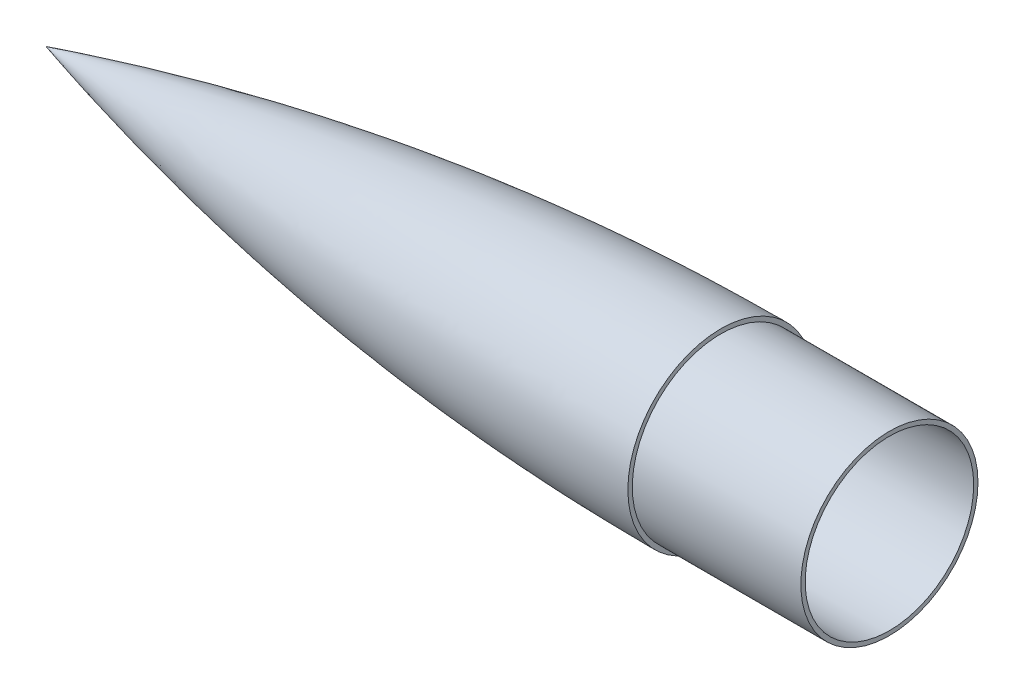
from build123d import *

# Parameters (mm, degrees)
BOSS_EXTRUDE2_DEPTH      = 71.4
BOSS_EXTRUDE2_DEPTH_BACK = 10
SKETCH7_R                = 37.5
SKETCH7_R_2              = 35.68


with BuildPart() as part:
    # Sketch6 → Revolve1 (revolve)
    with BuildSketch(Plane.XY):
        with BuildLine():
            add(Edge.make_bspline(
                [(0, 0.000773686), (0.345837081, 0.097913039), (1.048861774, 0.294893917), (2.658804783, 0.744910728), (4.053557927, 1.130839742), (5.859110481, 1.629238964), (7.4449339, 2.063004405), (9.561107041, 2.639174776), (12.031731905, 3.305427777), (14.95864462, 4.086722796), (18.28128803, 4.961677348), (21.619538634, 5.829353926), (25.788137705, 6.898189705), (30.800356023, 8.160252936), (35.816708136, 9.394330637), (40.841342365, 10.601594193), (45.87030729, 11.786766239), (50.904823346, 12.9501928), (56.785447795, 14.275517838), (65.198696746, 16.114081378), (73.627596987, 17.879432312), (82.07158253, 19.571461259), (92.221500813, 21.513709315), (109.165721029, 24.603653307), (127.869230818, 27.637744384), (146.634286906, 30.26464954), (163.735036766, 32.318446728), (174.005722776, 33.461475939), (184.286037164, 34.515191531), (194.577348102, 35.457150565), (204.878113597, 36.287219685), (213.467762549, 36.904293409), (220.342435031, 37.353141106), (227.220133715, 37.75715841), (233.239870853, 38.071431948), (238.401716288, 38.312770004), (242.702957325, 38.49518804), (246.146416964, 38.629902708), (249.586229399, 38.753396186), (253.033645652, 38.865667159), (256.46919635, 38.966714436), (259.925366913, 39.056536942), (263.348226534, 39.135133723), (266.826889882, 39.202503943), (270.213132828, 39.258646887), (273.75770095, 39.303561958), (276.606326241, 39.333037839), (279.440738032, 39.351284936), (281.598838185, 39.363917591), (283.944232781, 39.368596368), (285.031559311, 39.370000002), (285.75, 39.370000002)],
                knots=[0.083339184, 0.083339184, 0.083339184, 0.083339184, 0.083339184, 0.088305037, 0.093270891, 0.098236744, 0.103202598, 0.108168451, 0.113134305, 0.123066011, 0.132997715, 0.142929419, 0.152861123, 0.162792827, 0.18265623, 0.202519633, 0.212451338, 0.222383043, 0.242246454, 0.262109863, 0.281973272, 0.321700076, 0.341563488, 0.3614269, 0.401153715, 0.520334158, 0.56006097, 0.579924379, 0.599787787, 0.639514601, 0.679241414, 0.699104823, 0.718968231, 0.738831638, 0.758695045, 0.778558452, 0.788490156, 0.798421859, 0.808353563, 0.818285267, 0.828216971, 0.838148675, 0.848080378, 0.858012082, 0.867943786, 0.87787549, 0.887807193, 0.897738897, 0.902704749, 0.9076706, 0.917602304, 0.917602304, 0.917602304, 0.917602304, 0.917602304], degree=4))
            Line((0, 0.000773686), (7.072205141, 0.000773686))
            add(Edge.make_bspline(
                [(7.072205141, 0.000773686), (7.37488273, 0.083491425), (8.087763714, 0.278009605), (9.668024639, 0.708007227), (12.031731905, 1.345427777), (14.95864462, 2.126722796), (18.28128803, 3.001677347), (21.619538634, 3.869353926), (25.788137705, 4.938189704), (30.800356023, 6.200252936), (35.816708136, 7.434330637), (40.841342365, 8.641594193), (45.87030729, 9.826766239), (50.904823346, 10.990192799), (56.785447795, 12.315517838), (65.198696746, 14.154081378), (73.627596987, 15.919432312), (82.07158253, 17.611461259), (92.221500813, 19.553709315), (109.165721029, 22.643653307), (127.869230818, 25.677744384), (146.634286906, 28.30464954), (163.735036766, 30.358446727), (174.005722776, 31.501475938), (184.286037164, 32.555191531), (194.577348102, 33.497150565), (204.878113597, 34.327219685), (213.467762549, 34.944293408), (220.342435031, 35.393141105), (227.220133715, 35.79715841), (233.239870853, 36.111431948), (238.401716288, 36.352770003), (242.702957325, 36.535188039), (246.146416964, 36.669902707), (249.586229399, 36.793396185), (253.033645652, 36.905667159), (256.46919635, 37.006714436), (259.925366913, 37.096536942), (263.348226534, 37.175133723), (266.826889882, 37.242503943), (270.213132829, 37.298646887), (273.75770095, 37.343561958), (276.606326242, 37.373037838), (279.440738032, 37.391284936), (281.598838185, 37.403917591), (283.944232781, 37.408596368), (285.031559311, 37.410000001), (285.75, 37.410000001)],
                knots=[0.104491997, 0.104491997, 0.104491997, 0.104491997, 0.104491997, 0.108168451, 0.113134305, 0.123066011, 0.132997715, 0.142929419, 0.152861123, 0.162792827, 0.18265623, 0.202519633, 0.212451338, 0.222383043, 0.242246454, 0.262109863, 0.281973272, 0.321700076, 0.341563488, 0.3614269, 0.401153715, 0.520334158, 0.56006097, 0.579924379, 0.599787787, 0.639514601, 0.679241414, 0.699104823, 0.718968231, 0.738831638, 0.758695045, 0.778558452, 0.788490156, 0.798421859, 0.808353563, 0.818285267, 0.828216971, 0.838148675, 0.848080378, 0.858012082, 0.867943786, 0.87787549, 0.887807193, 0.897738897, 0.902704749, 0.9076706, 0.917602304, 0.917602304, 0.917602304, 0.917602304, 0.917602304], degree=4))
            Line((285.749999997, 37.410000001), (285.749999997, 39.370000001))
        make_face()
    revolve(axis=Axis((0, 0.000773686, 0), (1, 0, 0)))

    # Sketch7 → Boss-Extrude2 (add, two sides: drawn at the far end of the back side and taken through both)
    with BuildSketch(Plane(origin=(285.749999997, 0, 0), x_dir=(0, 0, -1), z_dir=(1, 0, 0)).offset(-BOSS_EXTRUDE2_DEPTH_BACK)):
        Circle(SKETCH7_R)
        Circle(SKETCH7_R_2, mode=Mode.SUBTRACT)
    extrude(amount=BOSS_EXTRUDE2_DEPTH + BOSS_EXTRUDE2_DEPTH_BACK)


solid = part.part
